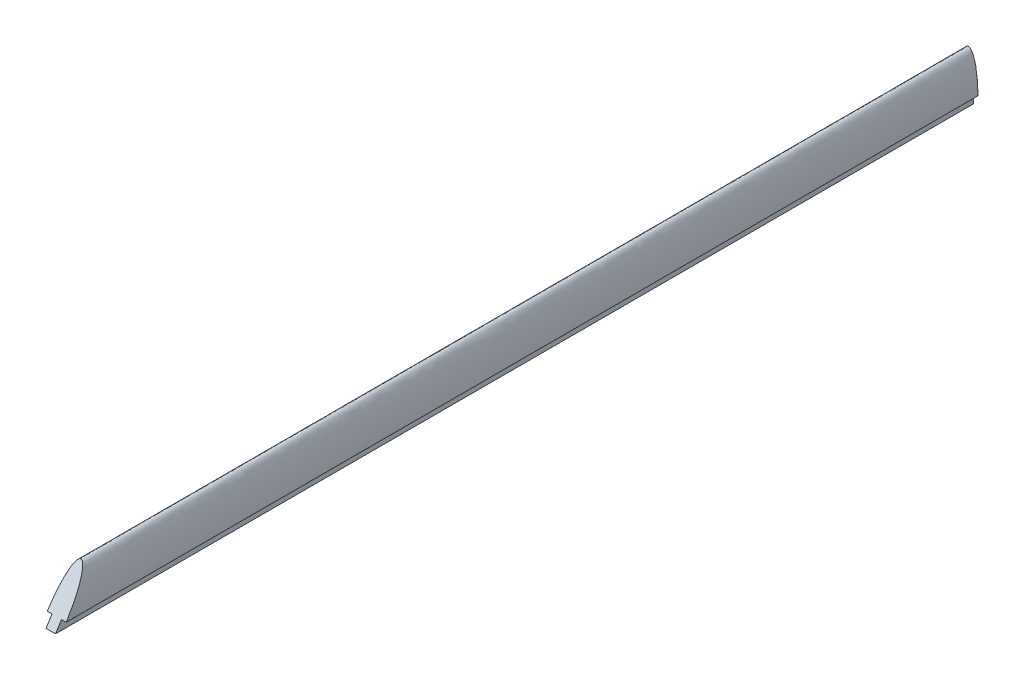
from build123d import *

# Parameters (mm, degrees)
PROFILE_EXTRUDE_DEPTH               = 2000
FLUSH_SUPPORT_CUT_REACH             = 2003.699
FLUSH_SUPPORT_CUT_DIRECTION_2_REACH = 2003.699


with BuildPart() as part:
    # Cross Section → Profile Extrude (new body)
    with BuildSketch(Plane.XY):
        with BuildLine():
            Line((10, 0), (20, 0))
            add(Edge.make_bspline(
                [(20, 0), (20, 80), (0, 80), (-20, 80), (-20, 0)],
                knots=[1.570796327, 1.570796327, 1.570796327, 3.141592654, 3.141592654, 4.71238898, 4.71238898, 4.71238898], degree=2, weights=[1, 0.707106781, 1, 0.707106781, 1]))
            Line((-20, 0), (-10, 0))
            Line((-10, 0), (-10, -20))
            Line((-10, -20), (10, -20))
            Line((10, -20), (10, 0))
        make_face()
    extrude(amount=PROFILE_EXTRUDE_DEPTH)

    # Flush Support Cut Sketch → Flush Support Cut (cut, up to next)
    with BuildSketch(Plane(origin=(0, 0, 0), x_dir=(0, 0, -1), z_dir=(1, 0, 0)), mode=Mode.PRIVATE) as flush_support_cut_sk1:
        Polygon((-2000, -126.123848559), (-1869.256226534, 80), (-2000, 80), align=None)
    flush_support_cut_tool1 = extrude(flush_support_cut_sk1.sketch, amount=-FLUSH_SUPPORT_CUT_REACH, mode=Mode.PRIVATE) & part.part
    add(flush_support_cut_tool1.solids().sort_by_distance((0, 11.29205, 1956.418742))[0], mode=Mode.SUBTRACT)

    # Flush Support Cut Sketch → Flush Support Cut direction 2 (cut, up to next)
    with BuildSketch(Plane(origin=(0, 0, 0), x_dir=(0, 0, -1), z_dir=(1, 0, 0)), mode=Mode.PRIVATE) as flush_support_cut_direction_2_sk1:
        Polygon((-2000, -126.123848559), (-1869.256226534, 80), (-2000, 80), align=None)
    flush_support_cut_direction_2_tool1 = extrude(flush_support_cut_direction_2_sk1.sketch, amount=FLUSH_SUPPORT_CUT_DIRECTION_2_REACH, mode=Mode.PRIVATE) & part.part
    add(flush_support_cut_direction_2_tool1.solids().sort_by_distance((0, 11.29205, 1956.418742))[0], mode=Mode.SUBTRACT)


solid = part.part
